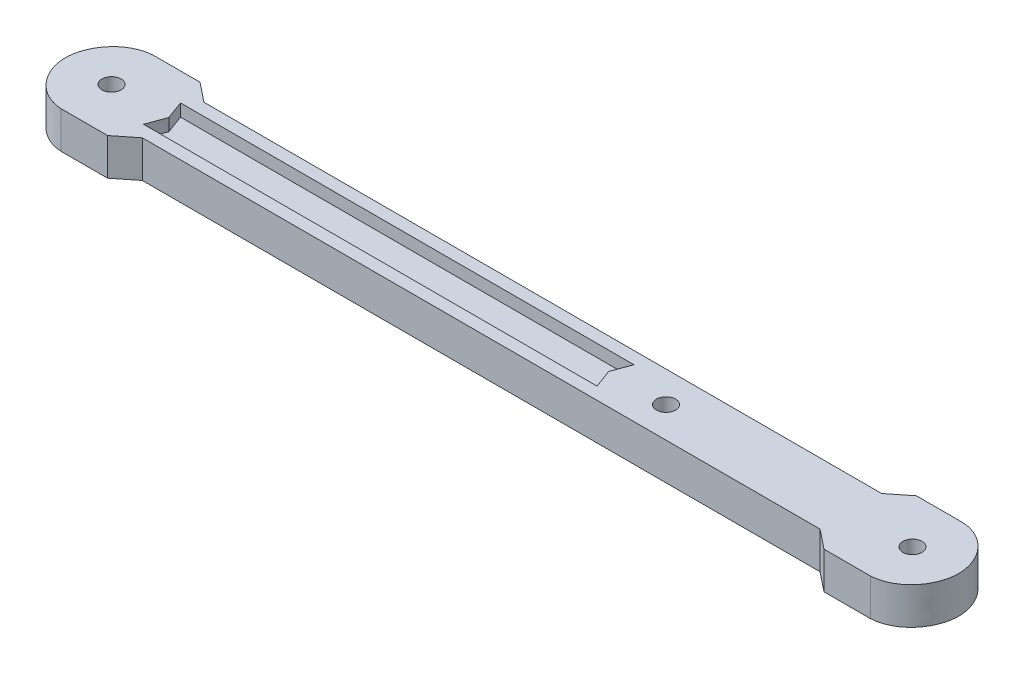
from build123d import *

# Parameters (mm, degrees)
ESQUISSE2_R             = 1.55
BOSS_EXTRU_1_DEPTH      = 6
ESQUISSE3_W             = 170
ESQUISSE3_H             = 35
ENL_V_MAT_EXTRU_1_DEPTH = 10
ENL_V_MAT_EXTRU_2_DEPTH = 2


with BuildPart() as part:
    # Esquisse2 → Boss.-Extru.1 (new body)
    with BuildSketch(Plane(origin=(0, 0, 0), x_dir=(1, 0, 0), z_dir=(0, 1, 0))):
        Polygon((30, 7.5), (-90, 7.5), (-100, 7.5), (-100, -7.5), (-90, -7.5), (30, -7.5), (40, -7.5), (50, -7.5), (50, 7.5), (40, 7.5), align=None)
        with Locations(Location((-90, 0, 0), (0, 0, 270))):
            Circle(ESQUISSE2_R, mode=Mode.SUBTRACT)
        with Locations(Location((0, 0, 0), (0, 0, 270))):
            Circle(ESQUISSE2_R, mode=Mode.SUBTRACT)
        with Locations(Location((40, 0, 0), (0, 0, 270))):
            Circle(ESQUISSE2_R, mode=Mode.SUBTRACT)
    extrude(amount=BOSS_EXTRU_1_DEPTH)

    # Esquisse3 → Enlèv. mat.-Extru.1 (cut)
    with BuildSketch(Plane.XZ):
        with Locations((-25, 0)):
            Rectangle(ESQUISSE3_W, ESQUISSE3_H)
        with BuildLine():
            Line((-90, -7.5), (-83.140864445, -7.5))
            Line((-83.140864445, -7.5), (-80, -5))
            Line((-80, -5), (0, -5))
            Line((0, -5), (30, -5))
            Line((30, -5), (33.140864445, -7.5))
            Line((33.140864445, -7.5), (40, -7.5))
            add(Edge.make_bspline(
                [(40, -7.5), (44.292893219, -7.707106781), (50.707106781, 0), (44.292893219, 7.707106781), (40, 7.5)],
                knots=[0, 0, 0, 0, 0.5, 1, 1, 1, 1], degree=3))
            Line((40, 7.5), (33.140864445, 7.5))
            Line((33.140864445, 7.5), (30, 5))
            Line((30, 5), (0, 5))
            Line((0, 5), (-80, 5))
            Line((-80, 5), (-83.140864445, 7.5))
            Line((-83.140864445, 7.5), (-90, 7.5))
            add(Edge.make_bspline(
                [(-90, -7.5), (-94.266151252, -7.718988485), (-100.733567708, 6.0631e-05), (-94.266713321, 7.718514748), (-90, 7.5)],
                knots=[0, 0, 0, 0, 0.500005708, 1, 1, 1, 1], degree=3))
        make_face(mode=Mode.SUBTRACT)
    extrude(amount=-ENL_V_MAT_EXTRU_1_DEPTH, mode=Mode.SUBTRACT)

    # Esquisse4 → Enlèv. mat.-Extru.2 (cut)
    with BuildSketch(Plane(origin=(0, 6, 0), x_dir=(1, 0, 0), z_dir=(0, 1, 0))):
        Polygon((-81.8, 3), (-80.7, 0), (-81.8, -3), (-8.2, -3), (-9.3, 0), (-8.2, 3), align=None)
    extrude(amount=-ENL_V_MAT_EXTRU_2_DEPTH, mode=Mode.SUBTRACT)


solid = part.part
